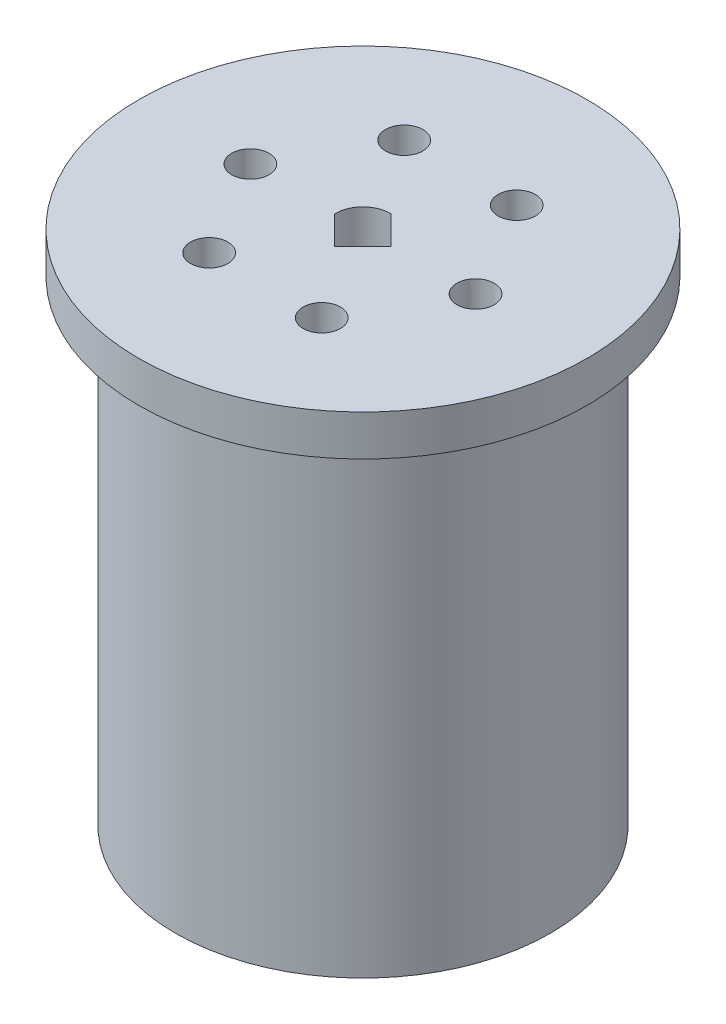
from build123d import *

# Parameters (mm, degrees)
SKETCH2_R           = 27.6
BOSS_EXTRUDE1_DEPTH = 70
CUT_EXTRUDE1_DEPTH  = 50
SKETCH3_R           = 2.75
CUT_EXTRUDE2_DEPTH  = 110
SKETCH4_R           = 33
BOSS_EXTRUDE2_DEPTH = 6
CUT_EXTRUDE3_START  = 6
SKETCH3_2_R         = 2.75
CUT_EXTRUDE3_DEPTH  = 6
CUT_EXTRUDE4_DEPTH  = 81


with BuildPart() as part:
    # Sketch2 → Boss-Extrude1 (new body)
    with BuildSketch(Plane(origin=(0, 0, 0), x_dir=(1, 0, 0), z_dir=(0, 1, 0))):
        Circle(SKETCH2_R)
    extrude(amount=BOSS_EXTRUDE1_DEPTH)

    # Sketch2<4> → Cut-Extrude1 (cut)
    with BuildSketch(Plane(origin=(0, 0, 0), x_dir=(1, 0, 0), z_dir=(0, 1, 0))):
        with BuildLine():
            Line((-3.997017731, -0.154432059), (0.158545764, -4.309995554))
            Line((0.158545764, -4.309995554), (4.314106781, -0.154434537))
            Line((4.314106781, -0.154434537), (0.162994526, 3.996677718))
            ThreePointArc((0.162994526, 3.996677718), (-2.825395827, 2.831455177), (-3.997017731, -0.154432059))
        make_face()
    extrude(amount=CUT_EXTRUDE1_DEPTH, mode=Mode.SUBTRACT)

    # Sketch3 → Cut-Extrude2 (cut)
    with BuildSketch(Plane(origin=(0, 70, 0), x_dir=(1, 0, 0), z_dir=(0, 1, 0))):
        with Locations((-8.28675, 14.35307203)):
            Circle(SKETCH3_R)
        with Locations((-16.5735, 0)):
            Circle(SKETCH3_R)
        with Locations((-8.28675, -14.35307203)):
            Circle(SKETCH3_R)
        with Locations((8.28675, -14.35307203)):
            Circle(SKETCH3_R)
        with Locations((16.5735, 0)):
            Circle(SKETCH3_R)
        with Locations((8.28675, 14.35307203)):
            Circle(SKETCH3_R)
    extrude(amount=-CUT_EXTRUDE2_DEPTH, mode=Mode.SUBTRACT)

    # Sketch4 → Boss-Extrude2 (add)
    with BuildSketch(Plane(origin=(0, 70, 0), x_dir=(1, 0, 0), z_dir=(0, 1, 0))):
        Circle(SKETCH4_R)
    extrude(amount=BOSS_EXTRUDE2_DEPTH)

    # Sketch3<2> → Cut-Extrude3 (cut)
    with BuildSketch(Plane(origin=(0, 70, 0), x_dir=(1, 0, 0), z_dir=(0, 1, 0)).offset(CUT_EXTRUDE3_START)):
        with Locations((-8.28675, 14.35307203)):
            Circle(SKETCH3_2_R)
        with Locations((-16.5735, 0)):
            Circle(SKETCH3_2_R)
        with Locations((-8.28675, -14.35307203)):
            Circle(SKETCH3_2_R)
        with Locations((8.28675, -14.35307203)):
            Circle(SKETCH3_2_R)
        with Locations((16.5735, 0)):
            Circle(SKETCH3_2_R)
        with Locations((8.28675, 14.35307203)):
            Circle(SKETCH3_2_R)
    extrude(amount=-CUT_EXTRUDE3_DEPTH, mode=Mode.SUBTRACT)

    # Sketch2<5> → Cut-Extrude4 (cut)
    with BuildSketch(Plane(origin=(0, 0, 0), x_dir=(1, 0, 0), z_dir=(0, 1, 0))):
        with BuildLine():
            Line((-3.997017731, -0.154432059), (0.158545764, -4.309995554))
            Line((0.158545764, -4.309995554), (4.314106781, -0.154434537))
            Line((4.314106781, -0.154434537), (0.162994526, 3.996677718))
            ThreePointArc((0.162994526, 3.996677718), (-2.825395827, 2.831455177), (-3.997017731, -0.154432059))
        make_face()
    extrude(amount=CUT_EXTRUDE4_DEPTH, mode=Mode.SUBTRACT)


solid = part.part
